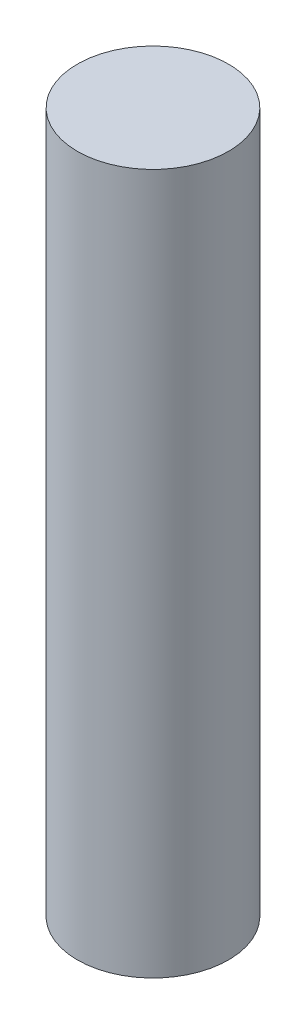
from build123d import *

# Parameters (mm, degrees)
SKETCH1_R           = 4.35
BOSS_EXTRUDE1_DEPTH = 40.3


with BuildPart() as part:
    # Sketch1 → Boss-Extrude1 (new body)
    with BuildSketch(Plane(origin=(0, 0, 0), x_dir=(1, 0, 0), z_dir=(0, 1, 0))):
        with Locations(Location((0, 0, 0), (0, 0, 270))):
            Circle(SKETCH1_R)
    extrude(amount=BOSS_EXTRUDE1_DEPTH)


solid = part.part
